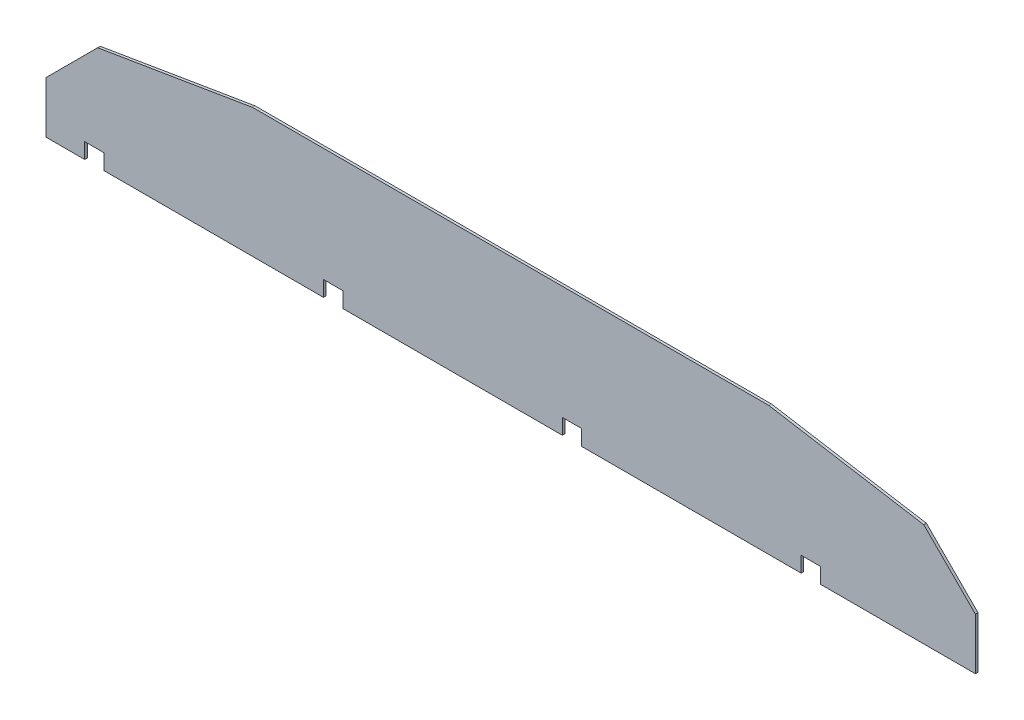
from build123d import *

# Parameters (mm, degrees)
AUFSATZ_LINEAR_AUSTRAGEN1_DEPTH = 2


with BuildPart() as part:
    # Skizze1 → Aufsatz-Linear austragen1 (new body)
    with BuildSketch(Plane.XY):
        Polygon((-720, 0), (-690, 0), (-690, 12), (-675, 12), (-675, 0), (-505, 0), (-505, 12), (-490, 12), (-490, 0), (-320, 0), (-320, 12), (-305, 12), (-305, 0), (-135, 0), (-135, 12), (-120, 12), (-120, 0), (0, 0), (0, 40), (-40, 80), (-160, 100), (-560, 100), (-680, 80), (-720, 40), align=None)
    extrude(amount=AUFSATZ_LINEAR_AUSTRAGEN1_DEPTH)


solid = part.part
